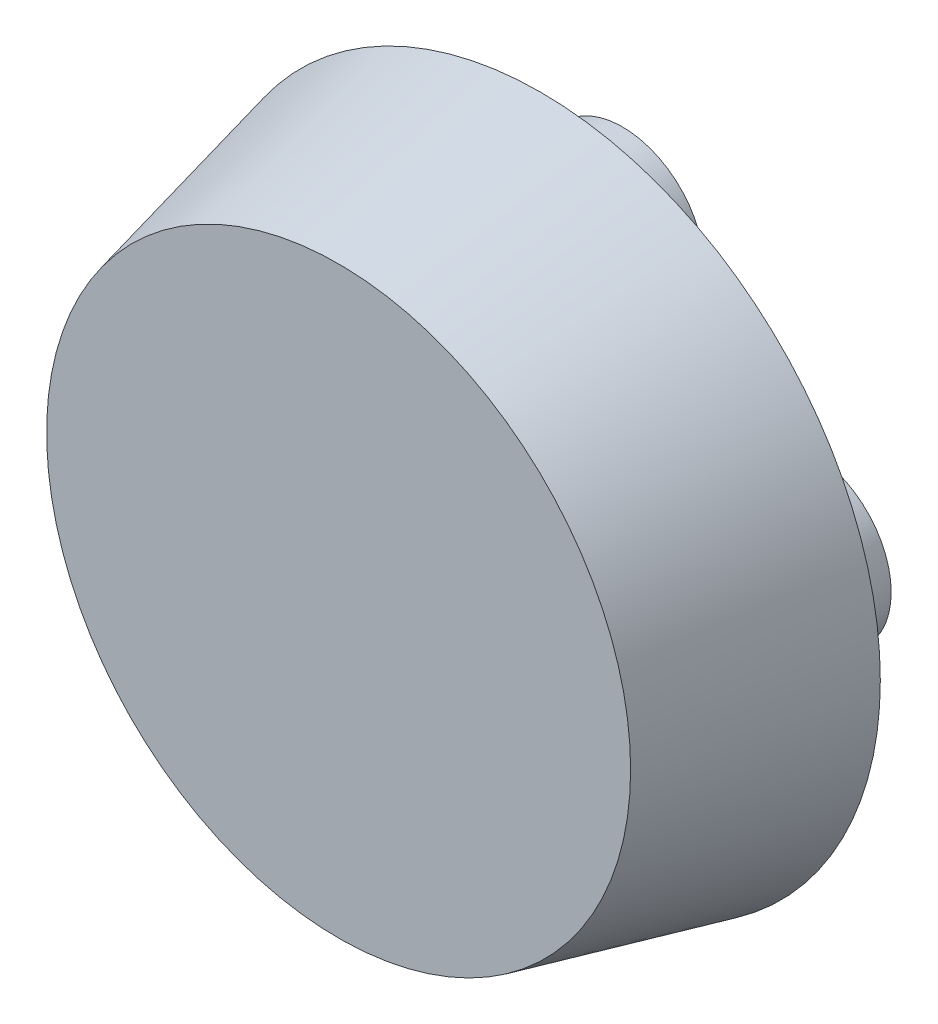
from build123d import *

# Parameters (mm, degrees)
CABLES_SKETCH_R = 35
CABLES_DEPTH    = 35


with BuildPart() as part:
    # Big Plug Sketch → Big Plug (revolve)
    with BuildSketch(Plane(origin=(0, 0, 0), x_dir=(0, 0, -1), z_dir=(1, 0, 0))):
        with BuildLine():
            Line((531.601551916, 125), (531.601551916, 0))
            Line((531.601551916, 0), (635, 0))
            ThreePointArc((635, 0), (630.771254316, 73.161634266), (618.141339438, 145.348837209))
            Line((618.141339438, 145.348837209), (531.601551916, 125))
        make_face()
    revolve(axis=Axis((0, 0, 0), (0, 0, -1)))

    # Cables Sketch → Cables (add)
    with BuildSketch(Plane.XY.offset(-618.141339438)):
        with Locations((0, 80)):
            Circle(CABLES_SKETCH_R)
        with Locations((80, 0)):
            Circle(CABLES_SKETCH_R)
        with Locations((0, -80)):
            Circle(CABLES_SKETCH_R)
        with Locations((-80, 0)):
            Circle(CABLES_SKETCH_R)
    extrude(amount=-CABLES_DEPTH)


solid = part.part
